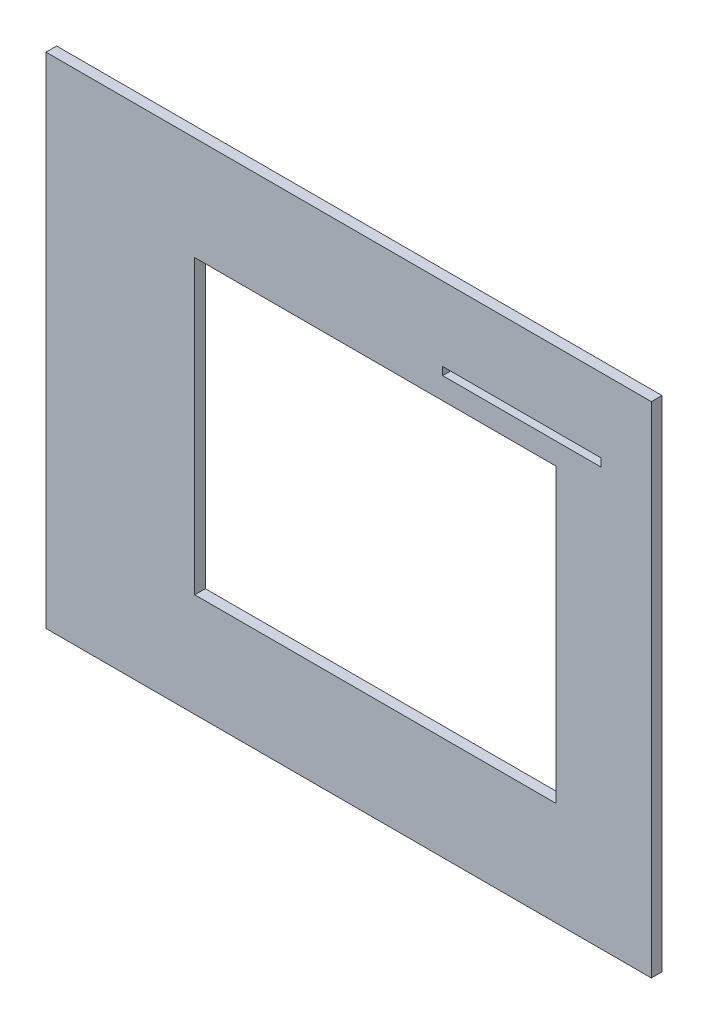
from build123d import *

# Parameters (mm, degrees)
SKETCH1_W                    = 114
SKETCH1_H                    = 94
SKETCH1_W_2                  = 68
SKETCH1_H_2                  = 55
BOSS_EXTRUDE1_DEPTH          = 2
CUT_EXTRUDE_THIN1_DEPTH      = 105.71269135
CUT_EXTRUDE_THIN1_DEPTH_BACK = 105.71269135
SKETCH3_W                    = 29.874962845
SKETCH3_H                    = 1.5
SKETCH2_W                    = 90.5
SKETCH2_H                    = 77
SKETCH2_W_2                  = 88.5
SKETCH2_H_2                  = 75
EXTRUDE_THIN3_DEPTH          = 2


with BuildPart() as part:
    # Sketch1 → Boss-Extrude1 (new body)
    with BuildSketch(Plane.XY):
        with Locations((29.037817342, 12.650999294)):
            Rectangle(SKETCH1_W, SKETCH1_H)
        with Locations((34.037817342, 12.650999294)):
            Rectangle(SKETCH1_W_2, SKETCH1_H_2, mode=Mode.SUBTRACT)
    extrude(amount=BOSS_EXTRUDE1_DEPTH)

    # Sketch3 → Cut-Extrude-Thin1 (cut, two sides: drawn at the far end of the back side and taken through both)
    with BuildSketch(Plane.XY.offset(2).offset(-CUT_EXTRUDE_THIN1_DEPTH_BACK)):
        with Locations((61.660151902, 44.986424276)):
            Rectangle(SKETCH3_W, SKETCH3_H)
    extrude(amount=CUT_EXTRUDE_THIN1_DEPTH + CUT_EXTRUDE_THIN1_DEPTH_BACK, mode=Mode.SUBTRACT)

    # Sketch2 → Extrude-Thin3 (add)
    with BuildSketch(Plane(origin=(0, 0, 0), x_dir=(-1, 0, 0), z_dir=(0, 0, -1))):
        with Locations((-34.037817342, 12.650999294)):
            Rectangle(SKETCH2_W, SKETCH2_H)
        with Locations((-34.037817342, 12.650999294)):
            Rectangle(SKETCH2_W_2, SKETCH2_H_2, mode=Mode.SUBTRACT)
    extrude(amount=EXTRUDE_THIN3_DEPTH)


solid = part.part
